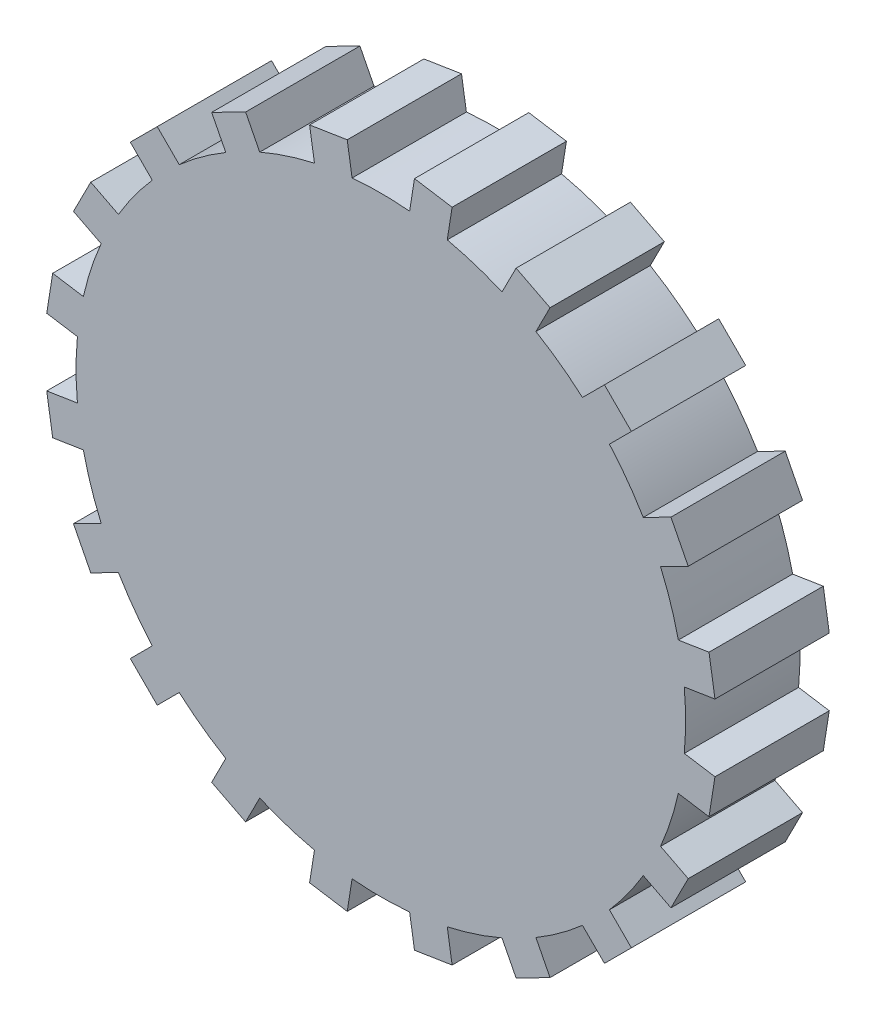
from build123d import *

# Parameters (mm, degrees)
SKETCH_1_R               = 40
EXTRUDE_1_DEPTH          = 15
EXTRUDE_2_DEPTH          = 15
PATTERN_CIRCULAR_1_COUNT = 20


with BuildPart() as part:
    # 草图1 → 凸台-拉伸1 (new body)
    with BuildSketch(Plane.XY):
        Circle(SKETCH_1_R)
    extrude(amount=EXTRUDE_1_DEPTH)

    # 草图2 → 凸台-拉伸2 (add)
    with BuildSketch(Plane.XY):
        Polygon((39.404775616, 3.709940518), (43.849373149, 4.41389561), (43.067200824, 9.352337313), (38.622603291, 8.648382221), align=None)
    extrude_2 = extrude(amount=EXTRUDE_2_DEPTH)

    # 阵列(圆周)1: 凸台-拉伸2 ×20 about axis
    pattern_circular_1_axis = Axis((0, 0, 15), (0, 0, -1))
    for i in range(1, PATTERN_CIRCULAR_1_COUNT):
        add(extrude_2.rotate(pattern_circular_1_axis, i * 360 / PATTERN_CIRCULAR_1_COUNT))


solid = part.part
